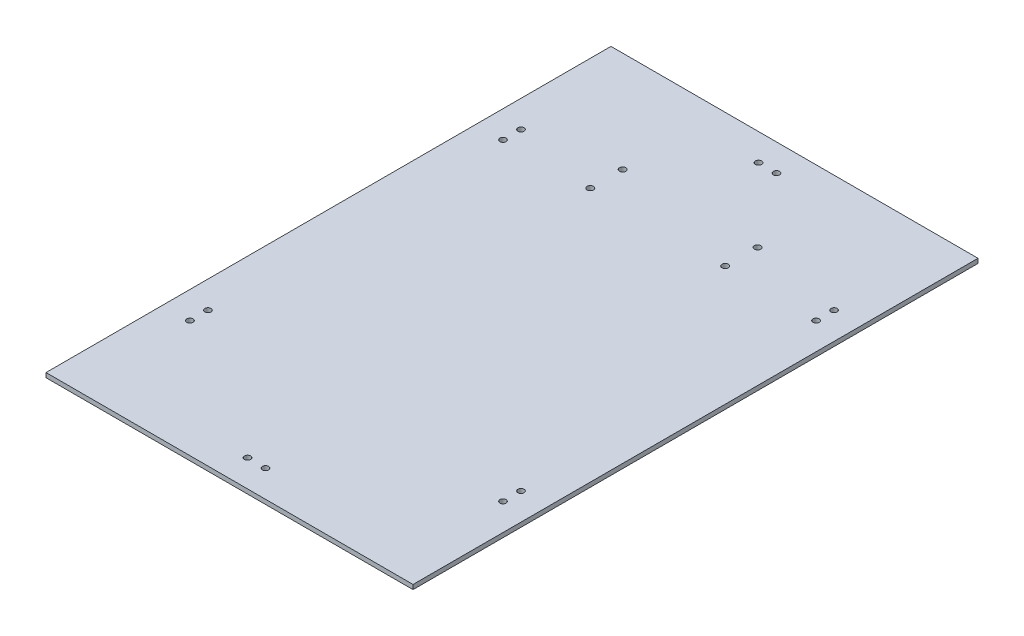
from build123d import *

# Parameters (mm, degrees)
SKETCH1_W                        = 259.08
SKETCH1_H                        = 398.78
BOSS_EXTRUDE1_DEPTH              = 3.175
F_16_0_177_DIAMETER_HOLE1_D      = 4.4958
F_11_64_0_17188_DIAMETER_HOLE1_D = 4.365752


with BuildPart() as part:
    # Sketch1 → Boss-Extrude1 (new body)
    with BuildSketch(Plane(origin=(0, 0, 0), x_dir=(1, 0, 0), z_dir=(0, 1, 0))):
        with Locations((-24.465369934, 31.444323398)):
            Rectangle(SKETCH1_W, SKETCH1_H)
    extrude(amount=BOSS_EXTRUDE1_DEPTH)

    # #16 (0.177) Diameter Hole1 (through all)
    with Locations(Plane(origin=(0, 0, 0), x_dir=(-1, 0, 0), z_dir=(0, -1, 0))):
        with Locations((-20.619630066, 159.714323398), (-20.619630066, 136.854323398), (74.630369934, 136.854323398), (74.630369934, 159.714323398)):
            Hole(F_16_0_177_DIAMETER_HOLE1_D / 2)

    # 11/64 (0.17188) Diameter Hole1 (through all)
    with Locations(Plane(origin=(0, 0, 0), x_dir=(-1, 0, 0), z_dir=(0, -1, 0))):
        with Locations((-86.024630066, 148.284323398), (30.815369934, 211.784323398), (134.955369934, 148.284323398), (134.955369934, -85.395676602), (18.115369934, 211.784323398), (-86.024630066, -85.395676602), (134.955369934, -72.695676602), (134.955369934, 135.584323398), (-86.024630066, 135.584323398), (-86.024630066, -72.695676602), (18.115369934, -148.895676602), (30.815369934, -148.895676602)):
            Hole(F_11_64_0_17188_DIAMETER_HOLE1_D / 2)


solid = part.part
